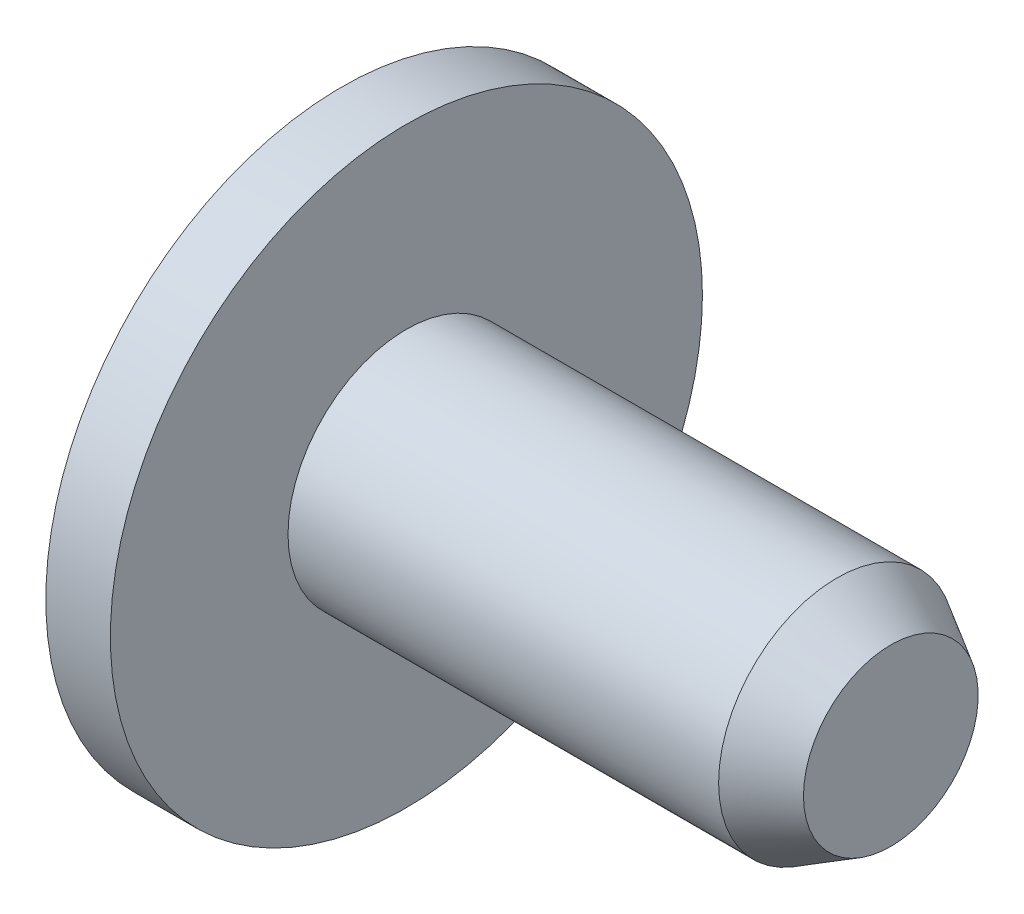
from build123d import *

# Parameters (mm, degrees)
ESQUISSE2_W                  = 0.4
ESQUISSE2_H                  = 0.4
ENL_V_MAT_EXTRU_1_DEPTH      = 6.353036521
R_P_TITION_CIRCULAIRE1_COUNT = 2
R_P_TITION_CIRCULAIRE1_ANGLE = 90
ESQUISSE3_R                  = 2.75
BOSS_EXTRU_1_DEPTH           = 0.6


with BuildPart() as part:
    # Esquisse1 → Révolution1 (revolve)
    with BuildSketch(Plane.XY, mode=Mode.PRIVATE) as r_volution1_sk:
        with BuildLine():
            Line((0, 1.1), (0, 2.05))
            Line((0, 2.05), (-0.8, 1.835640646))
            ThreePointArc((-0.8, 1.835640646), (-1.391310546, 1.001196357), (-1.6, 0))
            Line((-1.6, 0), (4.5, 0))
            Line((4.5, 0), (4.5, 0.811324865))
            Line((4.5, 0.811324865), (4, 1.1))
            Line((4, 1.1), (0, 1.1))
        make_face()
    revolve(r_volution1_sk.sketch.rotate(Axis((-2.182265798, 0, 0), (1, 0, 0)), 90), axis=Axis((-2.182265798, 0, 0), (1, 0, 0)))

    # Esquisse2 → Enlèv. mat.-Extru.1 (cut, symmetric)
    with BuildSketch(Plane.XY):
        with Locations((-1.4, 0)):
            Rectangle(ESQUISSE2_W, ESQUISSE2_H)
    enl_v_mat_extru_1 = extrude(amount=ENL_V_MAT_EXTRU_1_DEPTH, both=True, mode=Mode.SUBTRACT)

    # Répétition circulaire1: Enlèv. mat.-Extru.1 ×2 about axis
    r_p_tition_circulaire1_axis = Axis((-2.182265798, 0, 0), (-1, 0, 0))
    for i in range(1, R_P_TITION_CIRCULAIRE1_COUNT):
        add(enl_v_mat_extru_1.rotate(r_p_tition_circulaire1_axis, i * R_P_TITION_CIRCULAIRE1_ANGLE / (R_P_TITION_CIRCULAIRE1_COUNT - 1)), mode=Mode.SUBTRACT)

    # Esquisse3 → Boss.-Extru.1 (add)
    with BuildSketch(Plane(origin=(0, 0, 0), x_dir=(0, 0, -1), z_dir=(1, 0, 0))):
        Circle(ESQUISSE3_R)
    extrude(amount=-BOSS_EXTRU_1_DEPTH)


solid = part.part
